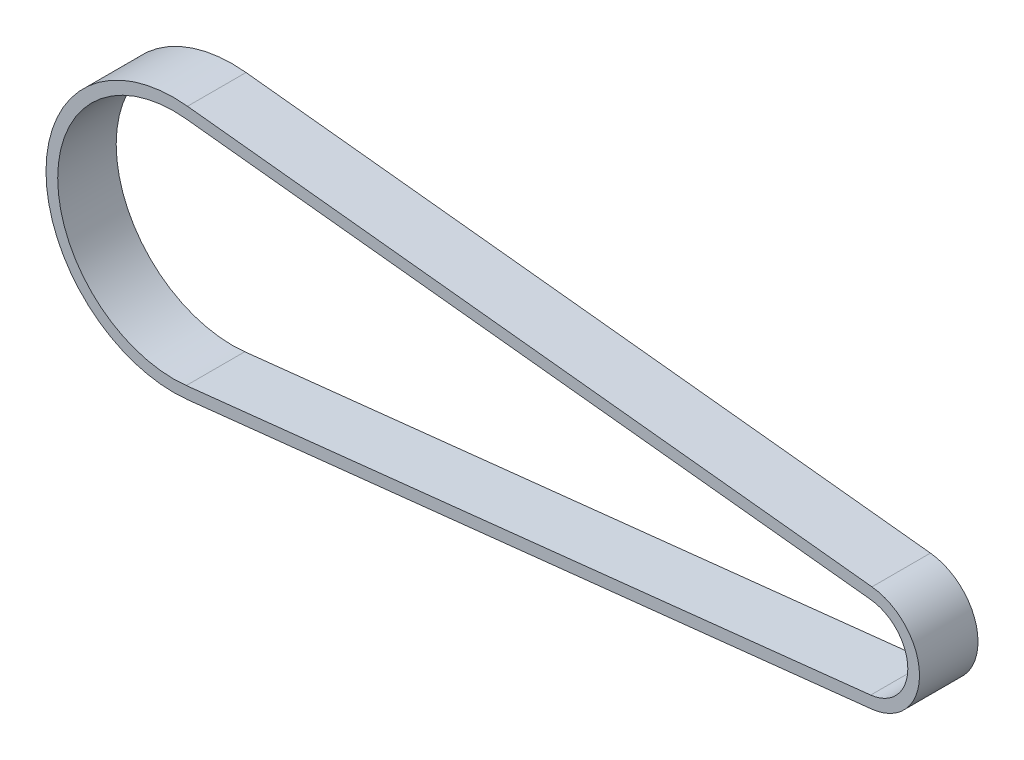
from build123d import *

# Parameters (mm, degrees)
EXTRUDE_THIN1_DEPTH = 5


with BuildPart() as part:
    # Sketch2 → Extrude-Thin1 (new, symmetric)
    with BuildSketch(Plane.XY):
        with BuildLine():
            Line((119.362802251, -9.042922382), (2.352577797, -21.717951163))
            ThreePointArc((2.352577797, -21.717951163), (-21.844999845, -0.002600872), (2.347406239, 21.718510744))
            Line((2.347406239, 21.718510744), (119.360645561, 9.071344863))
            ThreePointArc((119.360645561, 9.071344863), (127.49170886, 0.015179199), (119.362802251, -9.042922382))
        make_face()
        with BuildLine():
            Line((119.147414035, -7.054554228), (2.13718958, -19.729583009))
            ThreePointArc((2.13718958, -19.729583009), (-19.84499986, -0.002362751), (2.1324915, 19.730091358))
            Line((2.1324915, 19.730091358), (119.145730822, 7.082925477))
            ThreePointArc((119.145730822, 7.082925477), (125.491708874, 0.014941078), (119.147414035, -7.054554228))
        make_face(mode=Mode.SUBTRACT)
    extrude(amount=EXTRUDE_THIN1_DEPTH, both=True)


solid = part.part
